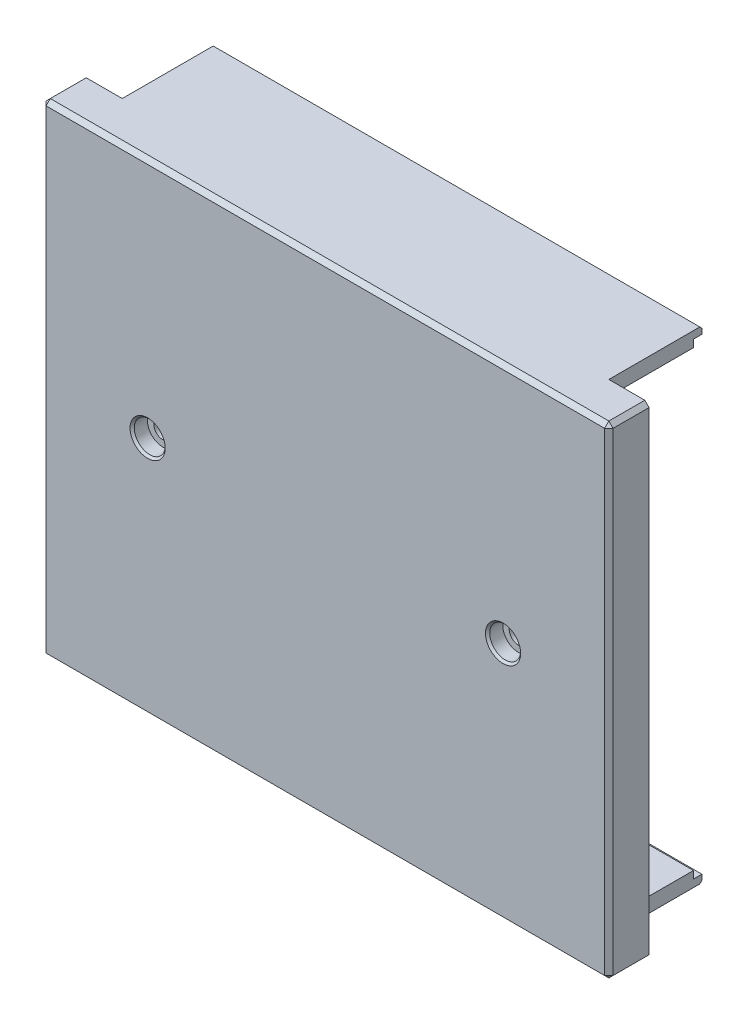
from build123d import *

# Parameters (mm, degrees)
SKETCH1_W           = 134
SKETCH1_H           = 114
BOSS_EXTRUDE1_DEPTH = 9.5
SKETCH2_W           = 115
SKETCH2_H           = 3.5
BOSS_EXTRUDE2_DEPTH = 20
SKETCH3_R           = 2.15
CUT_EXTRUDE1_DEPTH  = 179.387919995
SKETCH4_R           = 3.65
CUT_EXTRUDE2_DEPTH  = 3.6
CHAMFER1_SIZE       = 1
CHAMFER4_SIZE       = 0.5
SKETCH5_W           = 115
SKETCH5_H           = 1.75
BOSS_EXTRUDE3_DEPTH = 2
CHAMFER5_SIZE       = 0.5


with BuildPart() as part:
    # Sketch1 → Boss-Extrude1 (new body)
    with BuildSketch(Plane.XY):
        with Locations((67, 57)):
            Rectangle(SKETCH1_W, SKETCH1_H)
    extrude(amount=BOSS_EXTRUDE1_DEPTH)

    # Sketch2 → Boss-Extrude2 (add)
    with BuildSketch(Plane(origin=(0, 0, 0), x_dir=(-1, 0, 0), z_dir=(0, 0, -1))):
        Polygon((-67, 114), (-124.5, 114), (-124.5, 110.5), (-9.5, 110.5), (-9.5, 114), align=None)
        with Locations((-67, 1.75)):
            Rectangle(SKETCH2_W, SKETCH2_H)
    extrude(amount=BOSS_EXTRUDE2_DEPTH)

    # Sketch3 → Cut-Extrude1 (cut, through all)
    with BuildSketch(Plane.XY.offset(9.5)):
        with Locations((25, 57)):
            Circle(SKETCH3_R)
        with Locations((109, 57)):
            Circle(SKETCH3_R)
    extrude(amount=-CUT_EXTRUDE1_DEPTH, mode=Mode.SUBTRACT)

    # Sketch4 → Cut-Extrude2 (cut)
    with BuildSketch(Plane.XY.offset(9.5)):
        with Locations((25, 57)):
            Circle(SKETCH4_R)
        with Locations((109, 57)):
            Circle(SKETCH4_R)
    extrude(amount=-CUT_EXTRUDE2_DEPTH, mode=Mode.SUBTRACT)

    # Chamfer1
    chamfer1_edges = [part.edges().sort_by_distance(p)[0] for p in [
        (134, 57, 9.5),
        (67, 114, 9.5),
        (0, 57, 9.5),
        (67, 0, 9.5),
        (0, 114, 4.75),
        (134, 114, 4.75),
        (134, 0, 4.75),
        (0, 0, 4.75),
    ]]
    chamfer(chamfer1_edges, length=CHAMFER1_SIZE)

    # Chamfer4
    chamfer4_edges = [part.edges().sort_by_distance(p)[0] for p in [
        (21.35, 57, 9.5),
        (105.35, 57, 9.5),
    ]]
    chamfer(chamfer4_edges, length=CHAMFER4_SIZE)

    # Sketch5 → Boss-Extrude3 (add)
    with BuildSketch(Plane(origin=(0, 0, -20), x_dir=(-1, 0, 0), z_dir=(0, 0, -1))):
        with Locations((-67, 113.125)):
            Rectangle(SKETCH5_W, SKETCH5_H)
        with Locations((-67, 0.875)):
            Rectangle(SKETCH5_W, SKETCH5_H)
    extrude(amount=BOSS_EXTRUDE3_DEPTH)

    # Chamfer5
    chamfer5_edges = [part.edges().sort_by_distance(p)[0] for p in [
        (67, 114, -22),
        (67, 0, -22),
    ]]
    chamfer(chamfer5_edges, length=CHAMFER5_SIZE)


solid = part.part
